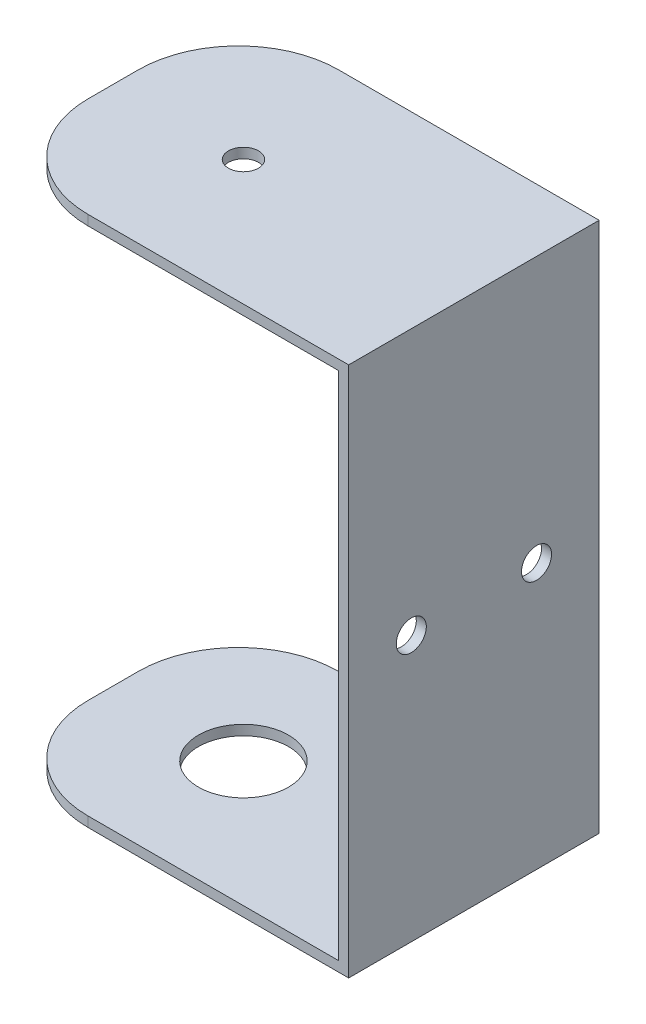
from build123d import *

# Parameters (mm, degrees)
EXTRUIR_L_MINA1_DEPTH = 25
CROQUIS2_R            = 1.5
CORTAR_EXTRUIR1_DEPTH = 1
CROQUIS5_R            = 4.5
CORTAR_EXTRUIR2_DEPTH = 1
CROQUIS6_R            = 1.5
CORTAR_EXTRUIR3_DEPTH = 1
REDONDEO1_R           = 10


with BuildPart() as part:
    # Croquis1 → Extruir-Lámina1 (new body)
    with BuildSketch(Plane.XY):
        Polygon((-35, 15.149283258), (0, 15.149283258), (0, -35.850716742), (-35, -35.850716742), (-35, -36.850716742), (1, -36.850716742), (1, 16.149283258), (-35, 16.149283258), align=None)
    extrude(amount=EXTRUIR_L_MINA1_DEPTH)

    # Croquis2 → Cortar-Extruir1 (cut)
    with BuildSketch(Plane(origin=(0, 16.149283258, 0), x_dir=(1, 0, 0), z_dir=(0, 1, 0))):
        with Locations(Location((-22, -12.5, 0), (0, 0, 180))):
            Circle(CROQUIS2_R)
    extrude(amount=-CORTAR_EXTRUIR1_DEPTH, mode=Mode.SUBTRACT)

    # Croquis5 → Cortar-Extruir2 (cut)
    with BuildSketch(Plane.XZ.offset(36.850716742)):
        with Locations((-22, 12.5)):
            Circle(CROQUIS5_R)
    extrude(amount=-CORTAR_EXTRUIR2_DEPTH, mode=Mode.SUBTRACT)

    # Croquis6 → Cortar-Extruir3 (cut)
    with BuildSketch(Plane(origin=(1, 0, 0), x_dir=(0, 0, -1), z_dir=(1, 0, 0))):
        with Locations(Location((-6.25, -10.350716742, 0), (0, 0, 90))):
            Circle(CROQUIS6_R)
        with Locations(Location((-18.75, -10.350716742, 0), (0, 0, 90))):
            Circle(CROQUIS6_R)
    extrude(amount=-CORTAR_EXTRUIR3_DEPTH, mode=Mode.SUBTRACT)

    # Redondeo1
    redondeo1_edges = [part.edges().sort_by_distance(p)[0] for p in [
        (-35, -36.350716742, 25),
        (-35, 15.649283258, 25),
        (-35, -36.350716742, 0),
        (-35, 15.649283258, 0),
    ]]
    fillet(redondeo1_edges, radius=REDONDEO1_R)


solid = part.part
